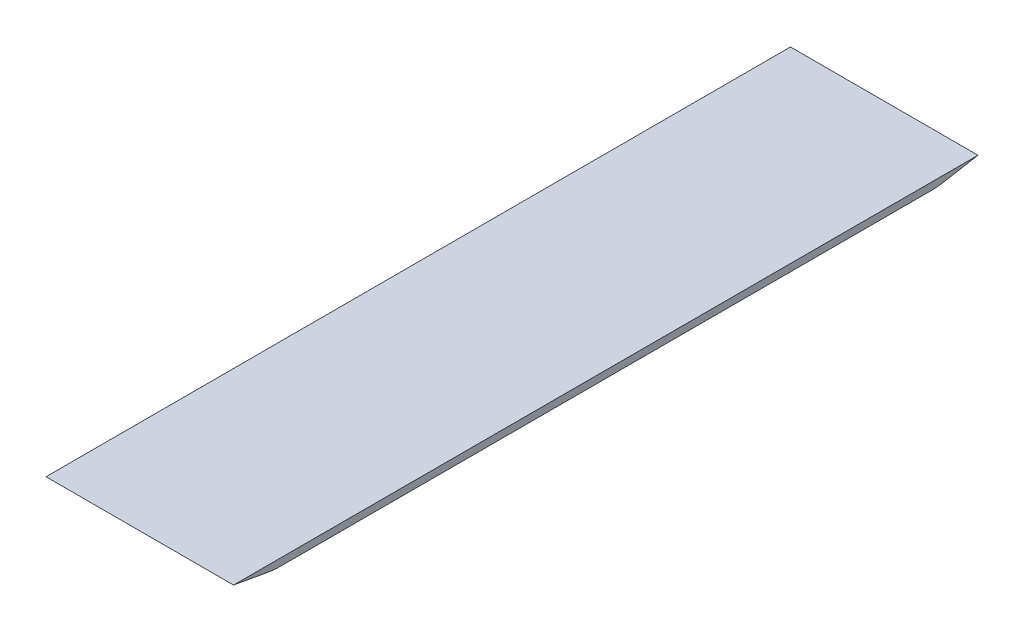
from build123d import *

# Parameters (mm, degrees)
BOSS_EXTRUDE1_DEPTH = 130
FILLET1_R           = 50


with BuildPart() as part:
    # Sketch1 → Boss-Extrude1 (new body)
    with BuildSketch(Plane(origin=(0, 0, 0), x_dir=(0, 0, -1), z_dir=(1, 0, 0))):
        Polygon((28, -5), (488, -5), (516, 0), (0, 0), align=None)
    extrude(amount=BOSS_EXTRUDE1_DEPTH)

    # Fillet1
    fillet1_edges = [part.edges().sort_by_distance(p)[0] for p in [
        (65, -5, -488),
        (65, -5, -28),
    ]]
    fillet(fillet1_edges, radius=FILLET1_R)


solid = part.part
